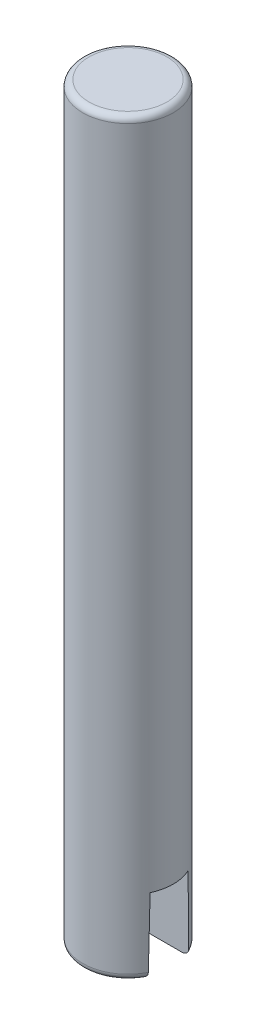
from build123d import *

# Parameters (mm, degrees)
SKETCH1_R           = 3.625
BOSS_EXTRUDE1_DEPTH = 60
SKETCH3_W           = 10
SKETCH3_H           = 3.25
CUT_EXTRUDE2_DEPTH  = 6
CUT_EXTRUDE2_DRAFT  = -1
FILLET2_R           = 0.5


with BuildPart() as part:
    # Sketch1 → Boss-Extrude1 (new body)
    with BuildSketch(Plane(origin=(0, 0, 0), x_dir=(1, 0, 0), z_dir=(0, 1, 0))):
        with Locations(Location((0, 0, 0), (0, 0, 270))):
            Circle(SKETCH1_R)
    extrude(amount=BOSS_EXTRUDE1_DEPTH)


with BuildPart() as cut_extrude2_tool:
    # Sketch3 → Cut-Extrude2 (with draft: the straight prism first)
    with BuildSketch(Plane(origin=(0, 0, 0), x_dir=(-1, 0, 0), z_dir=(0, -1, 0))):
        Rectangle(SKETCH3_W, SKETCH3_H)
    extrude(amount=-CUT_EXTRUDE2_DEPTH)
    # Cut-Extrude2: the draft: its side faces are tilted about the plane it starts from
    cut_extrude2_sides = [cut_extrude2_tool.faces().sort_by_distance(p)[0] for p in [
        (0, 3, -1.625),
        (5, 3, 0),
        (0, 3, 1.625),
        (-5, 3, 0),
    ]]
    draft(cut_extrude2_sides, Plane(origin=(0, 0, 0), x_dir=(-1, 0, 0), z_dir=(0, -1, 0)), CUT_EXTRUDE2_DRAFT)


with BuildPart() as part_1:
    add(part.part)

    # Cut-Extrude2: cut by cut_extrude2_tool
    add(cut_extrude2_tool.part, mode=Mode.SUBTRACT)

    # Fillet2
    fillet2_edges = [part_1.edges().sort_by_distance(p)[0] for p in [
        (0, 60, -3.625),
        (1.903943276, 0, 3.08474067),
        (0, 0, -3.625),
    ]]
    fillet(fillet2_edges, radius=FILLET2_R)


solid = part_1.part
